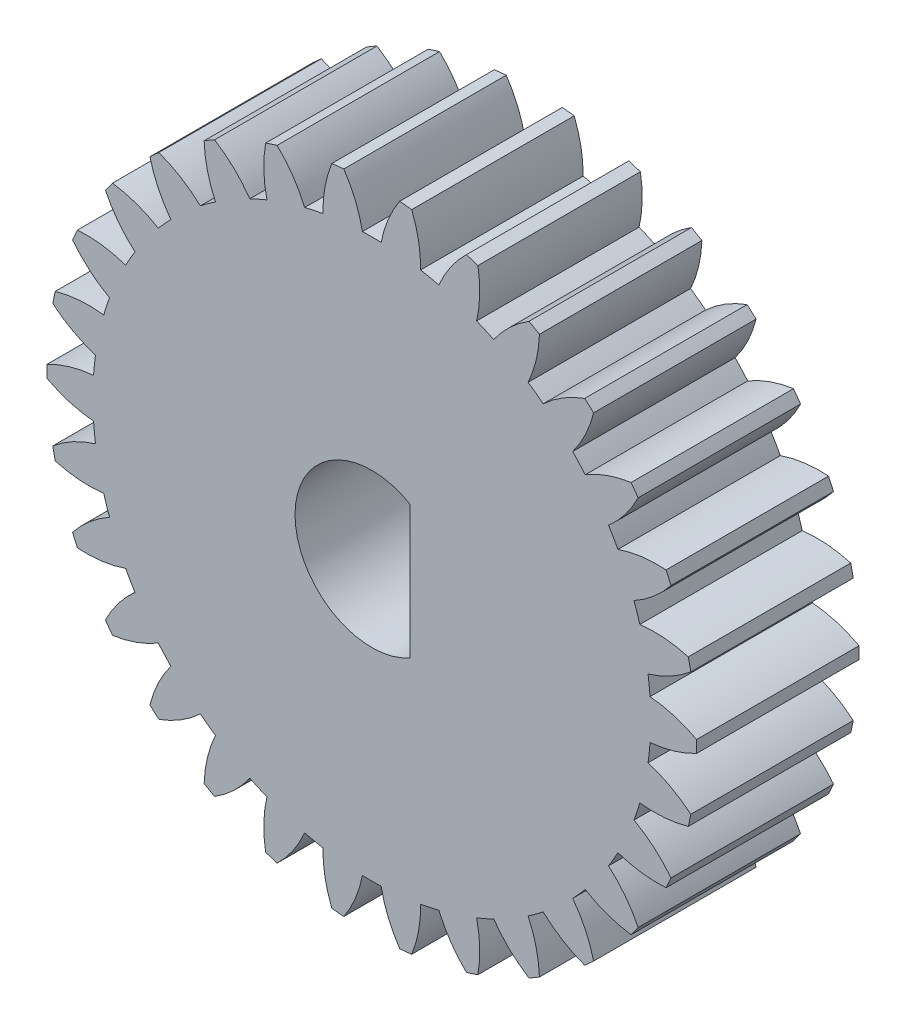
from build123d import *

# Parameters (mm, degrees)
BOSS_EXTRUDE1_DEPTH = 6.35


with BuildPart() as part:
    # Sketch1 → Boss-Extrude1 (new body)
    with BuildSketch(Plane.XY):
        with BuildLine():
            ThreePointArc((-12.697816386, -0.235497422), (-11.813791763, -0.59738778), (-10.875329548, -0.77558103))
            ThreePointArc((-10.875329548, -0.77558103), (-10.843222499, -1.139668609), (-10.798929867, -1.502475431))
            ThreePointArc((-10.798929867, -1.502475431), (-11.679835972, -1.871891997), (-12.469301299, -2.409673236))
            ThreePointArc((-12.469301299, -2.409673236), (-12.422474529, -2.640478473), (-12.371375965, -2.870375713))
            ThreePointArc((-12.371375965, -2.870375713), (-11.431428165, -3.040558844), (-10.476425141, -3.019740878))
            ThreePointArc((-10.476425141, -3.019740878), (-10.369321644, -3.369196839), (-10.250565133, -3.714866506))
            ThreePointArc((-10.250565133, -3.714866506), (-11.035415303, -4.259361111), (-11.695817912, -4.949529611))
            ThreePointArc((-11.695817912, -4.949529611), (-11.602027312, -5.165555367), (-11.50424705, -5.379804811))
            ThreePointArc((-11.50424705, -5.379804811), (-10.549456303, -5.350842896), (-9.619650684, -5.131923559))
            ThreePointArc((-9.619650684, -5.131923559), (-9.442231676, -5.451475), (-9.254201515, -5.764900088))
            ThreePointArc((-9.254201515, -5.764900088), (-9.908694031, -6.460675706), (-10.411171159, -7.273067791))
            ThreePointArc((-10.411171159, -7.273067791), (-10.274515829, -7.464872704), (-10.134327336, -7.654110624))
            ThreePointArc((-10.134327336, -7.654110624), (-9.206422578, -7.427269438), (-8.342451332, -7.019816555))
            ThreePointArc((-8.342451332, -7.019816555), (-8.102470875, -7.295497545), (-7.853384884, -7.562979874))
            ThreePointArc((-7.853384884, -7.562979874), (-8.348915283, -8.379627771), (-8.671506268, -9.278738009))
            ThreePointArc((-8.671506268, -9.278738009), (-8.497958701, -9.437939284), (-8.321488887, -9.593895075))
            ThreePointArc((-8.321488887, -9.593895075), (-7.461024009, -9.179088665), (-6.700646826, -8.600909883))
            ThreePointArc((-6.700646826, -8.600909883), (-6.408593216, -8.820671839), (-6.109337648, -9.030521148))
            ThreePointArc((-6.109337648, -9.030521148), (-6.424248875, -9.932349892), (-6.552854943, -10.878882852))
            ThreePointArc((-6.552854943, -10.878882852), (-6.35, -10.998522628), (-6.144961443, -11.114380274))
            ThreePointArc((-6.144961443, -11.114380274), (-5.389542888, -10.529737672), (-4.765991899, -9.806102178))
            ThreePointArc((-4.765991899, -9.806102178), (-4.434629283, -9.960340447), (-4.098283042, -10.103385314))
            ThreePointArc((-4.098283042, -10.103385314), (-4.218811964, -11.050980662), (-4.147812412, -12.003568311))
            ThreePointArc((-4.147812412, -12.003568311), (-3.924515829, -12.078417757), (-3.699869697, -12.149113722))
            ThreePointArc((-3.699869697, -12.149113722), (-3.082512882, -11.420186615), (-2.623040257, -10.582720752))
            ThreePointArc((-2.623040257, -10.582720752), (-2.266850769, -10.664694383), (-1.908113801, -10.734683061))
            ThreePointArc((-1.908113801, -10.734683061), (-1.828992725, -11.686630549), (-1.561490576, -12.603640235))
            ThreePointArc((-1.561490576, -12.603640235), (-1.327511483, -12.630428071), (-1.093075891, -12.652872603))
            ThreePointArc((-1.093075891, -12.652872603), (-0.640762271, -11.811518602), (-0.365449169, -10.896823648))
            ThreePointArc((-0.365449169, -10.896823648), (0, -10.90295), (0.365449169, -10.896823648))
            ThreePointArc((0.365449169, -10.896823648), (0.640762271, -11.811518602), (1.093075891, -12.652872603))
            ThreePointArc((1.093075891, -12.652872603), (1.327511483, -12.630428071), (1.561490576, -12.603640235))
            ThreePointArc((1.561490576, -12.603640235), (1.828992725, -11.686630549), (1.908113801, -10.734683061))
            ThreePointArc((1.908113801, -10.734683061), (2.266850769, -10.664694383), (2.623040257, -10.582720752))
            ThreePointArc((2.623040257, -10.582720752), (3.082512882, -11.420186615), (3.699869697, -12.149113722))
            ThreePointArc((3.699869697, -12.149113722), (3.924515829, -12.078417757), (4.147812412, -12.003568311))
            ThreePointArc((4.147812412, -12.003568311), (4.218811964, -11.050980662), (4.098283042, -10.103385314))
            ThreePointArc((4.098283042, -10.103385314), (4.434629283, -9.960340447), (4.765991899, -9.806102178))
            ThreePointArc((4.765991899, -9.806102178), (5.389542888, -10.529737672), (6.144961443, -11.114380274))
            ThreePointArc((6.144961443, -11.114380274), (6.35, -10.998522628), (6.552854943, -10.878882852))
            ThreePointArc((6.552854943, -10.878882852), (6.424248875, -9.932349892), (6.109337648, -9.030521148))
            ThreePointArc((6.109337648, -9.030521148), (6.408593216, -8.820671839), (6.700646826, -8.600909883))
            ThreePointArc((6.700646826, -8.600909883), (7.461024009, -9.179088665), (8.321488887, -9.593895075))
            ThreePointArc((8.321488887, -9.593895075), (8.497958701, -9.437939284), (8.671506268, -9.278738009))
            ThreePointArc((8.671506268, -9.278738009), (8.348915283, -8.379627771), (7.853384884, -7.562979874))
            ThreePointArc((7.853384884, -7.562979874), (8.102470875, -7.295497545), (8.342451332, -7.019816555))
            ThreePointArc((8.342451332, -7.019816555), (9.206422578, -7.427269438), (10.134327336, -7.654110624))
            ThreePointArc((10.134327336, -7.654110624), (10.274515829, -7.464872704), (10.411171159, -7.273067791))
            ThreePointArc((10.411171159, -7.273067791), (9.908694031, -6.460675706), (9.254201515, -5.764900088))
            ThreePointArc((9.254201515, -5.764900088), (9.442231676, -5.451475), (9.619650684, -5.131923559))
            ThreePointArc((9.619650684, -5.131923559), (10.549456303, -5.350842896), (11.50424705, -5.379804811))
            ThreePointArc((11.50424705, -5.379804811), (11.602027312, -5.165555367), (11.695817912, -4.949529611))
            ThreePointArc((11.695817912, -4.949529611), (11.035415303, -4.259361111), (10.250565133, -3.714866506))
            ThreePointArc((10.250565133, -3.714866506), (10.369321644, -3.369196839), (10.476425141, -3.019740878))
            ThreePointArc((10.476425141, -3.019740878), (11.431428165, -3.040558844), (12.371375965, -2.870375713))
            ThreePointArc((12.371375965, -2.870375713), (12.422474529, -2.640478473), (12.469301299, -2.409673236))
            ThreePointArc((12.469301299, -2.409673236), (11.679835972, -1.871891997), (10.798929867, -1.502475431))
            ThreePointArc((10.798929867, -1.502475431), (10.843222499, -1.139668609), (10.875329548, -0.77558103))
            ThreePointArc((10.875329548, -0.77558103), (11.813791763, -0.59738778), (12.697816386, -0.235497422))
            ThreePointArc((12.697816386, -0.235497422), (12.7, 0), (12.697816386, 0.235497422))
            ThreePointArc((12.697816386, 0.235497422), (11.813791763, 0.59738778), (10.875329548, 0.77558103))
            ThreePointArc((10.875329548, 0.77558103), (10.843222499, 1.139668609), (10.798929867, 1.502475431))
            ThreePointArc((10.798929867, 1.502475431), (11.679835972, 1.871891997), (12.469301299, 2.409673236))
            ThreePointArc((12.469301299, 2.409673236), (12.422474529, 2.640478473), (12.371375965, 2.870375713))
            ThreePointArc((12.371375965, 2.870375713), (11.431428165, 3.040558844), (10.476425141, 3.019740878))
            ThreePointArc((10.476425141, 3.019740878), (10.369321644, 3.369196839), (10.250565133, 3.714866506))
            ThreePointArc((10.250565133, 3.714866506), (11.035415303, 4.259361111), (11.695817912, 4.949529611))
            ThreePointArc((11.695817912, 4.949529611), (11.602027312, 5.165555367), (11.50424705, 5.379804811))
            ThreePointArc((11.50424705, 5.379804811), (10.549456303, 5.350842896), (9.619650684, 5.131923559))
            ThreePointArc((9.619650684, 5.131923559), (9.442231676, 5.451475), (9.254201515, 5.764900088))
            ThreePointArc((9.254201515, 5.764900088), (9.908694031, 6.460675706), (10.411171159, 7.273067791))
            ThreePointArc((10.411171159, 7.273067791), (10.274515829, 7.464872704), (10.134327336, 7.654110624))
            ThreePointArc((10.134327336, 7.654110624), (9.206422578, 7.427269438), (8.342451332, 7.019816555))
            ThreePointArc((8.342451332, 7.019816555), (8.102470875, 7.295497545), (7.853384884, 7.562979874))
            ThreePointArc((7.853384884, 7.562979874), (8.348915283, 8.379627771), (8.671506268, 9.278738009))
            ThreePointArc((8.671506268, 9.278738009), (8.497958701, 9.437939284), (8.321488887, 9.593895075))
            ThreePointArc((8.321488887, 9.593895075), (7.461024009, 9.179088665), (6.700646826, 8.600909883))
            ThreePointArc((6.700646826, 8.600909883), (6.408593216, 8.820671839), (6.109337648, 9.030521148))
            ThreePointArc((6.109337648, 9.030521148), (6.424248875, 9.932349892), (6.552854943, 10.878882852))
            ThreePointArc((6.552854943, 10.878882852), (6.35, 10.998522628), (6.144961443, 11.114380274))
            ThreePointArc((6.144961443, 11.114380274), (5.389542888, 10.529737672), (4.765991899, 9.806102178))
            ThreePointArc((4.765991899, 9.806102178), (4.434629283, 9.960340447), (4.098283042, 10.103385314))
            ThreePointArc((4.098283042, 10.103385314), (4.218811964, 11.050980662), (4.147812412, 12.003568311))
            ThreePointArc((4.147812412, 12.003568311), (3.924515829, 12.078417757), (3.699869697, 12.149113722))
            ThreePointArc((3.699869697, 12.149113722), (3.082512882, 11.420186615), (2.623040257, 10.582720752))
            ThreePointArc((2.623040257, 10.582720752), (2.266850769, 10.664694383), (1.908113801, 10.734683061))
            ThreePointArc((1.908113801, 10.734683061), (1.828992725, 11.686630549), (1.561490576, 12.603640235))
            ThreePointArc((1.561490576, 12.603640235), (1.327511483, 12.630428071), (1.093075891, 12.652872603))
            ThreePointArc((1.093075891, 12.652872603), (0.640762271, 11.811518602), (0.365449169, 10.896823648))
            ThreePointArc((0.365449169, 10.896823648), (0, 10.90295), (-0.365449169, 10.896823648))
            ThreePointArc((-0.365449169, 10.896823648), (-0.640762271, 11.811518602), (-1.093075891, 12.652872603))
            ThreePointArc((-1.093075891, 12.652872603), (-1.327511483, 12.630428071), (-1.561490576, 12.603640235))
            ThreePointArc((-1.561490576, 12.603640235), (-1.828992725, 11.686630549), (-1.908113801, 10.734683061))
            ThreePointArc((-1.908113801, 10.734683061), (-2.266850769, 10.664694383), (-2.623040257, 10.582720752))
            ThreePointArc((-2.623040257, 10.582720752), (-3.082512882, 11.420186615), (-3.699869697, 12.149113722))
            ThreePointArc((-3.699869697, 12.149113722), (-3.924515829, 12.078417757), (-4.147812412, 12.003568311))
            ThreePointArc((-4.147812412, 12.003568311), (-4.218811964, 11.050980662), (-4.098283042, 10.103385314))
            ThreePointArc((-4.098283042, 10.103385314), (-4.434629283, 9.960340447), (-4.765991899, 9.806102178))
            ThreePointArc((-4.765991899, 9.806102178), (-5.389542888, 10.529737672), (-6.144961443, 11.114380274))
            ThreePointArc((-6.144961443, 11.114380274), (-6.35, 10.998522628), (-6.552854943, 10.878882852))
            ThreePointArc((-6.552854943, 10.878882852), (-6.424248875, 9.932349892), (-6.109337648, 9.030521148))
            ThreePointArc((-6.109337648, 9.030521148), (-6.408593216, 8.820671839), (-6.700646826, 8.600909883))
            ThreePointArc((-6.700646826, 8.600909883), (-7.461024009, 9.179088665), (-8.321488887, 9.593895075))
            ThreePointArc((-8.321488887, 9.593895075), (-8.497958701, 9.437939284), (-8.671506268, 9.278738009))
            ThreePointArc((-8.671506268, 9.278738009), (-8.348915283, 8.379627771), (-7.853384884, 7.562979874))
            ThreePointArc((-7.853384884, 7.562979874), (-8.102470875, 7.295497545), (-8.342451332, 7.019816555))
            ThreePointArc((-8.342451332, 7.019816555), (-9.206422578, 7.427269438), (-10.134327336, 7.654110624))
            ThreePointArc((-10.134327336, 7.654110624), (-10.274515829, 7.464872704), (-10.411171159, 7.273067791))
            ThreePointArc((-10.411171159, 7.273067791), (-9.908694031, 6.460675706), (-9.254201515, 5.764900088))
            ThreePointArc((-9.254201515, 5.764900088), (-9.442231676, 5.451475), (-9.619650684, 5.131923559))
            ThreePointArc((-9.619650684, 5.131923559), (-10.549456303, 5.350842896), (-11.50424705, 5.379804811))
            ThreePointArc((-11.50424705, 5.379804811), (-11.602027312, 5.165555367), (-11.695817912, 4.949529611))
            ThreePointArc((-11.695817912, 4.949529611), (-11.035415303, 4.259361111), (-10.250565133, 3.714866506))
            ThreePointArc((-10.250565133, 3.714866506), (-10.369321644, 3.369196839), (-10.476425141, 3.019740878))
            ThreePointArc((-10.476425141, 3.019740878), (-11.431428165, 3.040558844), (-12.371375965, 2.870375713))
            ThreePointArc((-12.371375965, 2.870375713), (-12.422474529, 2.640478473), (-12.469301299, 2.409673236))
            ThreePointArc((-12.469301299, 2.409673236), (-11.679835972, 1.871891997), (-10.798929867, 1.502475431))
            ThreePointArc((-10.798929867, 1.502475431), (-10.843222499, 1.139668609), (-10.875329548, 0.77558103))
            ThreePointArc((-10.875329548, 0.77558103), (-11.813791763, 0.59738778), (-12.697816386, 0.235497422))
            ThreePointArc((-12.697816386, 0.235497422), (-12.7, 0), (-12.697816386, -0.235497422))
        make_face()
        with BuildLine():
            Line((1.5, 2.598076211), (1.5, -2.598076211))
            ThreePointArc((1.5, -2.598076211), (-3, 0), (1.5, 2.598076211))
        make_face(mode=Mode.SUBTRACT)
    extrude(amount=BOSS_EXTRUDE1_DEPTH)


solid = part.part
